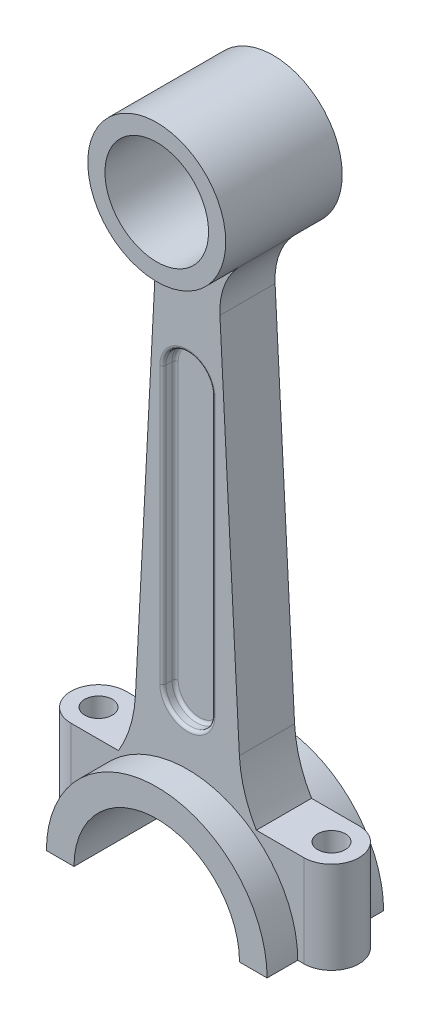
from build123d import *

# Parameters (mm, degrees)
SKETCH2_R               = 22.5
SKETCH2_R_2             = 16.9
BOSS_EXTRUDE1_DEPTH     = 19
BOSS_EXTRUDE1_2_DEPTH   = 19
BOSS_EXTRUDE2_DEPTH     = 9
CUT_EXTRUDE1_DEPTH      = 4
FILLET1_R               = 1
FILLET2_R               = 40
FILLET3_R               = 22.5
BOSS_EXTRUDE3_DEPTH     = 30
CUT_EXTRUDE2_DEPTH      = 135.709353795
CUT_EXTRUDE2_DEPTH_BACK = 135.709353795
CUT_EXTRUDE3_DEPTH      = 201.224099449
CUT_EXTRUDE3_DEPTH_BACK = 201.224099449
SKETCH7_R               = 4.5


with BuildPart() as part:
    # Sketch2 → Boss-Extrude1 (new, symmetric)
    with BuildSketch(Plane.XY):
        with Locations((0, 100.6)):
            Circle(SKETCH2_R)
        with Locations((0, 100.6)):
            Circle(SKETCH2_R_2, mode=Mode.SUBTRACT)
    extrude(amount=BOSS_EXTRUDE1_DEPTH, both=True)



with BuildPart() as body_2:
    # Sketch2 → Boss-Extrude1 2 (new, symmetric)
    with BuildSketch(Plane.XY):
        with BuildLine():
            Line((-36, -100.6), (-27, -100.6))
            ThreePointArc((-27, -100.6), (0, -73.6), (27, -100.6))
            Line((27, -100.6), (36, -100.6))
            ThreePointArc((36, -100.6), (0, -64.6), (-36, -100.6))
        make_face()
    extrude(amount=BOSS_EXTRUDE1_2_DEPTH, both=True)


with BuildPart() as part_1:
    add(part.part)

    add(body_2.part)  # Boss-Extrude2 merges body 2
    # Sketch2<3> → Boss-Extrude2 (add, symmetric)
    with BuildSketch(Plane.XY):
        with BuildLine():
            ThreePointArc((10, 80.444355629), (5.135562367, 78.693927801), (0, 78.1))
            Line((0, 78.1), (0, -64.6))
            ThreePointArc((0, -64.6), (9.233754228, -65.804342471), (17.849697213, -69.336789841))
            Line((17.849697213, -69.336789841), (10, 80.444355629))
        make_face()
        with BuildLine():
            Line((0, -64.6), (0, 78.1))
            ThreePointArc((0, 78.1), (-5.135562367, 78.693927801), (-10, 80.444355629))
            Line((-10, 80.444355629), (-17.849697213, -69.336789841))
            ThreePointArc((-17.849697213, -69.336789841), (-9.233754228, -65.804342471), (0, -64.6))
        make_face()
    extrude(amount=BOSS_EXTRUDE2_DEPTH, both=True)

    # Sketch3 → Cut-Extrude1 (cut)
    with BuildSketch(Plane.XY.offset(9)):
        with BuildLine():
            Line((8, 45), (8, -45))
            ThreePointArc((8, -45), (0, -53), (-8, -45))
            Line((-8, -45), (-8, 45))
            ThreePointArc((-8, 45), (0, 53), (8, 45))
        make_face()
    cut_extrude1 = extrude(amount=-CUT_EXTRUDE1_DEPTH, mode=Mode.SUBTRACT)

    # Mirror2: Cut-Extrude1 across plane
    add(cut_extrude1.mirror(Plane.XY), mode=Mode.SUBTRACT)

    # Fillet1
    fillet1_edges = [part_1.edges().sort_by_distance(p)[0] for p in [
        (0, 53, 5),
        (8, 0, 5),
        (0, -53, 5),
        (-8, 0, 5),
        (0, 53, 9),
        (-8, 0, 9),
        (0, -53, 9),
        (8, 0, 9),
        (0, 53, -9),
        (-8, 0, -9),
        (0, -53, -9),
        (8, 0, -9),
        (0, 53, -5),
        (-8, 0, -5),
        (0, -53, -5),
        (8, 0, -5),
    ]]
    fillet(fillet1_edges, radius=FILLET1_R)

    # Fillet2
    fillet2_edges = [part_1.edges().sort_by_distance(p)[0] for p in [
        (-17.849697213, -69.336789841, 0),
        (17.849697213, -69.336789841, 0),
    ]]
    fillet(fillet2_edges, radius=FILLET2_R)

    # Fillet3
    fillet3_edges = [part_1.edges().sort_by_distance(p)[0] for p in [
        (10, 80.444355629, 0),
        (-10, 80.444355629, 0),
    ]]
    fillet(fillet3_edges, radius=FILLET3_R)

    # Sketch5 → Boss-Extrude3 (add)
    with BuildSketch(Plane(origin=(0, -70.6, 0), x_dir=(-1, 0, 0), z_dir=(0, -1, 0))):
        with BuildLine():
            Line((38, -9), (-38, -9))
            ThreePointArc((-38, -9), (-47, 0), (-38, 9))
            Line((-38, 9), (38, 9))
            ThreePointArc((38, 9), (47, 0), (38, -9))
        make_face()
    extrude(amount=BOSS_EXTRUDE3_DEPTH)

    # Sketch6 → Cut-Extrude2 (cut, two sides: drawn at the far end of the back side and taken through both)
    with BuildSketch(Plane(origin=(0, 0, -9), x_dir=(-1, 0, 0), z_dir=(0, 0, -1)).offset(-CUT_EXTRUDE2_DEPTH_BACK)):
        with BuildLine():
            Line((-27, -100.6), (27, -100.6))
            ThreePointArc((27, -100.6), (0, -73.6), (-27, -100.6))
        make_face()
    extrude(amount=CUT_EXTRUDE2_DEPTH + CUT_EXTRUDE2_DEPTH_BACK, mode=Mode.SUBTRACT)

    # Sketch7 → Cut-Extrude3 (cut, two sides: drawn at the far end of the back side and taken through both)
    with BuildSketch(Plane(origin=(0, -70.6, 0), x_dir=(1, 0, 0), z_dir=(0, 1, 0)).offset(-CUT_EXTRUDE3_DEPTH_BACK)):
        with Locations(Location((38, 0, 0), (0, 0, 270))):
            Circle(SKETCH7_R)
        with Locations(Location((-38, 0, 0), (0, 0, 270))):
            Circle(SKETCH7_R)
    extrude(amount=CUT_EXTRUDE3_DEPTH + CUT_EXTRUDE3_DEPTH_BACK, mode=Mode.SUBTRACT)


solid = part_1.part
